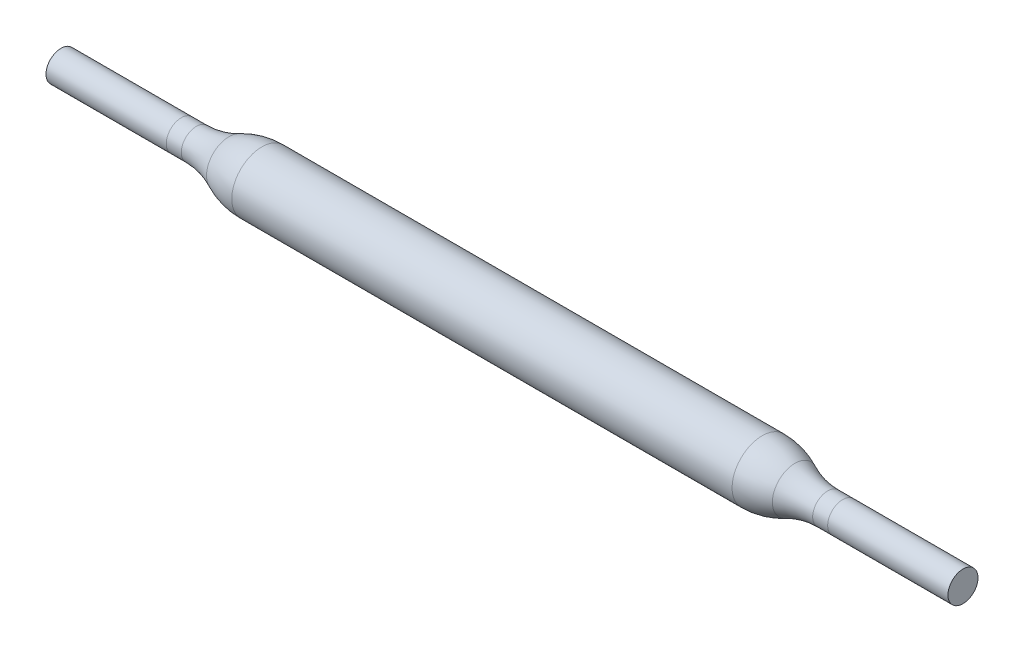
from build123d import *

# Parameters (mm, degrees)
SCALE1_SCALE = 18


with BuildPart() as part:
    # Sketch1 → Revolve1 (revolve)
    with BuildSketch(Plane.XY, mode=Mode.PRIVATE) as revolve1_sk:
        with BuildLine():
            Line((-30, 0), (30, 0))
            Line((30, 0), (30, 1))
            Line((30, 1), (21, 1))
            ThreePointArc((21, 1), (19.881966011, 1.126602828), (18.820550528, 1.5))
            ThreePointArc((18.820550528, 1.5), (17.759135045, 1.873397172), (16.641101056, 2))
            Line((16.641101056, 2), (-16.641101056, 2))
            ThreePointArc((-16.641101056, 2), (-17.759135045, 1.873397172), (-18.820550528, 1.5))
            ThreePointArc((-18.820550528, 1.5), (-19.881966011, 1.126602828), (-21, 1))
            Line((-21, 1), (-30, 1))
            Line((-30, 1), (-30, 0))
        make_face()
    revolve(revolve1_sk.sketch.rotate(Axis((-30, 0, 0), (1, 0, 0)), 180), axis=Axis((-30, 0, 0), (1, 0, 0)))


with BuildPart() as part_1:
    # Scale1: scaled about (0, 0, 0)
    add(part.part.scale(SCALE1_SCALE))


solid = part_1.part
